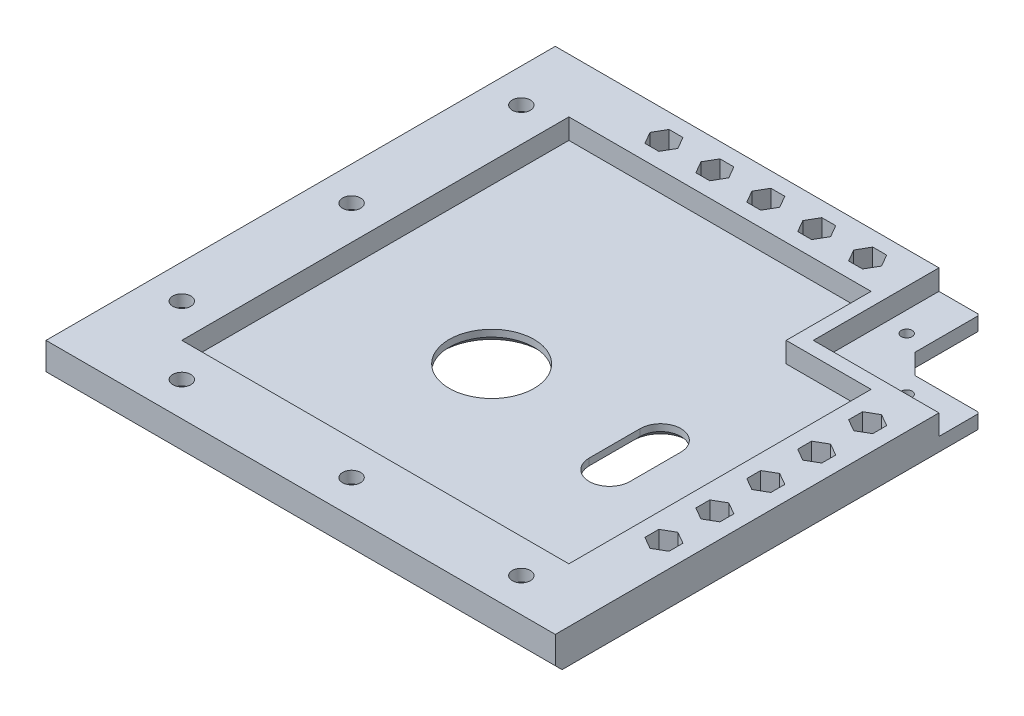
from build123d import *

# Parameters (mm, degrees)
SKETCH1_W           = 150
SKETCH1_H           = 150
SKETCH1_R           = 2.15
SKETCH1_R_2         = 2.65
BOSS_EXTRUDE1_DEPTH = 4
SKETCH2_R           = 2.65
BOSS_EXTRUDE2_DEPTH = 6
SKETCH3_R           = 4.5
SKETCH3_R_2         = 12.5
CUT_EXTRUDE1_DEPTH  = 6.5
SKETCH4_W           = 25
SKETCH4_H           = 25
CUT_EXTRUDE2_DEPTH  = 10
SKETCH5_W           = 37
SKETCH5_H           = 37
CUT_EXTRUDE3_DEPTH  = 6
SKETCH6_R           = 1.6
CUT_EXTRUDE4_DEPTH  = 24.5
CHAMFER1_SIZE       = 2
CUT_EXTRUDE5_DEPTH  = 24.5
CHAMFER2_SIZE       = 2
CHAMFER3_SIZE       = 0.5
CHAMFER4_SIZE       = 6


with BuildPart() as part:
    # Sketch1 → Boss-Extrude1 (new body)
    with BuildSketch(Plane(origin=(0, 0, 0), x_dir=(1, 0, 0), z_dir=(0, 1, 0))):
        with Locations((75, 75)):
            Rectangle(SKETCH1_W, SKETCH1_H)
        with Locations(Location((100, 142, 0), (0, 0, 270))):
            Circle(SKETCH1_R, mode=Mode.SUBTRACT)
        with Locations(Location((85, 142, 0), (0, 0, 270))):
            Circle(SKETCH1_R, mode=Mode.SUBTRACT)
        with Locations(Location((70, 142, 0), (0, 0, 270))):
            Circle(SKETCH1_R, mode=Mode.SUBTRACT)
        with Locations(Location((55, 142, 0), (0, 0, 270))):
            Circle(SKETCH1_R, mode=Mode.SUBTRACT)
        with Locations(Location((40, 142, 0), (0, 0, 270))):
            Circle(SKETCH1_R, mode=Mode.SUBTRACT)
        with Locations(Location((142, 40, 0), (0, 0, 270))):
            Circle(SKETCH1_R, mode=Mode.SUBTRACT)
        with Locations(Location((142, 55, 0), (0, 0, 270))):
            Circle(SKETCH1_R, mode=Mode.SUBTRACT)
        with Locations(Location((142, 70, 0), (0, 0, 270))):
            Circle(SKETCH1_R, mode=Mode.SUBTRACT)
        with Locations(Location((142, 85, 0), (0, 0, 270))):
            Circle(SKETCH1_R, mode=Mode.SUBTRACT)
        with Locations(Location((142, 100, 0), (0, 0, 270))):
            Circle(SKETCH1_R, mode=Mode.SUBTRACT)
        with Locations(Location((10, 30, 0), (0, 0, 270))):
            Circle(SKETCH1_R_2, mode=Mode.SUBTRACT)
        with Locations(Location((10, 80, 0), (0, 0, 270))):
            Circle(SKETCH1_R_2, mode=Mode.SUBTRACT)
        with Locations(Location((10, 130, 0), (0, 0, 270))):
            Circle(SKETCH1_R_2, mode=Mode.SUBTRACT)
        with Locations(Location((30, 10, 0), (0, 0, 270))):
            Circle(SKETCH1_R_2, mode=Mode.SUBTRACT)
        with Locations(Location((80, 10, 0), (0, 0, 270))):
            Circle(SKETCH1_R_2, mode=Mode.SUBTRACT)
        with Locations(Location((130, 10, 0), (0, 0, 270))):
            Circle(SKETCH1_R_2, mode=Mode.SUBTRACT)
    extrude(amount=BOSS_EXTRUDE1_DEPTH)

    # Sketch2 → Boss-Extrude2 (add)
    with BuildSketch(Plane(origin=(0, 4, 0), x_dir=(1, 0, 0), z_dir=(0, 1, 0))):
        Polygon((0, 150), (20, 150), (150, 150), (150, 134), (150, 20), (150, 0), (0, 0), align=None)
        with Locations(Location((10, 130, 0), (0, 0, 270))):
            Circle(SKETCH2_R, mode=Mode.SUBTRACT)
        with Locations(Location((10, 80, 0), (0, 0, 270))):
            Circle(SKETCH2_R, mode=Mode.SUBTRACT)
        with Locations(Location((10, 30, 0), (0, 0, 270))):
            Circle(SKETCH2_R, mode=Mode.SUBTRACT)
        with Locations(Location((30, 10, 0), (0, 0, 270))):
            Circle(SKETCH2_R, mode=Mode.SUBTRACT)
        with Locations(Location((80, 10, 0), (0, 0, 270))):
            Circle(SKETCH2_R, mode=Mode.SUBTRACT)
        with Locations(Location((130, 10, 0), (0, 0, 270))):
            Circle(SKETCH2_R, mode=Mode.SUBTRACT)
        Polygon((20, 134), (20, 20), (134, 20), (134, 109), (109, 109), (109, 134), align=None, mode=Mode.SUBTRACT)
        Polygon((59.099186911, 142), (57.049593456, 145.55), (52.950406544, 145.55), (50.900813089, 142), (52.950406544, 138.45), (57.049593456, 138.45), align=None, mode=Mode.SUBTRACT)
        Polygon((44.099186911, 142), (42.049593456, 145.55), (37.950406544, 145.55), (35.900813089, 142), (37.950406544, 138.45), (42.049593456, 138.45), align=None, mode=Mode.SUBTRACT)
        Polygon((74.099186911, 142), (72.049593456, 145.55), (67.950406544, 145.55), (65.900813089, 142), (67.950406544, 138.45), (72.049593456, 138.45), align=None, mode=Mode.SUBTRACT)
        Polygon((89.099186911, 142), (87.049593456, 145.55), (82.950406544, 145.55), (80.900813089, 142), (82.950406544, 138.45), (87.049593456, 138.45), align=None, mode=Mode.SUBTRACT)
        Polygon((104.099186911, 142), (102.049593456, 145.55), (97.950406544, 145.55), (95.900813089, 142), (97.950406544, 138.45), (102.049593456, 138.45), align=None, mode=Mode.SUBTRACT)
        Polygon((142, 80.900813089), (145.55, 82.950406544), (145.55, 87.049593456), (142, 89.099186911), (138.45, 87.049593456), (138.45, 82.950406544), align=None, mode=Mode.SUBTRACT)
        Polygon((142, 95.900813089), (145.55, 97.950406544), (145.55, 102.049593456), (142, 104.099186911), (138.45, 102.049593456), (138.45, 97.950406544), align=None, mode=Mode.SUBTRACT)
        Polygon((142, 65.900813089), (145.55, 67.950406544), (145.55, 72.049593456), (142, 74.099186911), (138.45, 72.049593456), (138.45, 67.950406544), align=None, mode=Mode.SUBTRACT)
        Polygon((142, 50.900813089), (145.55, 52.950406544), (145.55, 57.049593456), (142, 59.099186911), (138.45, 57.049593456), (138.45, 52.950406544), align=None, mode=Mode.SUBTRACT)
        Polygon((142, 35.900813089), (145.55, 37.950406544), (145.55, 42.049593456), (142, 44.099186911), (138.45, 42.049593456), (138.45, 37.950406544), align=None, mode=Mode.SUBTRACT)
    extrude(amount=BOSS_EXTRUDE2_DEPTH)

    # Sketch3 → Cut-Extrude1 (cut)
    with BuildSketch(Plane.XZ):
        with Locations(Location((10, -130, 0), (0, 0, 270))):
            Circle(SKETCH3_R)
        with Locations(Location((10, -80, 0), (0, 0, 270))):
            Circle(SKETCH3_R)
        with Locations(Location((10, -30, 0), (0, 0, 270))):
            Circle(SKETCH3_R)
        with Locations(Location((30, -10, 0), (0, 0, 270))):
            Circle(SKETCH3_R)
        with Locations(Location((80, -10, 0), (0, 0, 270))):
            Circle(SKETCH3_R)
        with Locations(Location((130, -10, 0), (0, 0, 270))):
            Circle(SKETCH3_R)
        with Locations(Location((65.625, -65.625, 0), (0, 0, 270))):
            Circle(SKETCH3_R_2)
    extrude(amount=-CUT_EXTRUDE1_DEPTH, mode=Mode.SUBTRACT)

    # Sketch4 → Cut-Extrude2 (cut)
    with BuildSketch(Plane(origin=(0, 10, 0), x_dir=(1, 0, 0), z_dir=(0, 1, 0))):
        with Locations((137.5, 137.5)):
            Rectangle(SKETCH4_W, SKETCH4_H)
    extrude(amount=-CUT_EXTRUDE2_DEPTH, mode=Mode.SUBTRACT)

    # Sketch5 → Cut-Extrude3 (cut)
    with BuildSketch(Plane(origin=(0, 10, 0), x_dir=(1, 0, 0), z_dir=(0, 1, 0))):
        with Locations((131.5, 131.5)):
            Rectangle(SKETCH5_W, SKETCH5_H)
    extrude(amount=-CUT_EXTRUDE3_DEPTH, mode=Mode.SUBTRACT)

    # Sketch6 → Cut-Extrude4 (cut)
    with BuildSketch(Plane(origin=(0, 4, 0), x_dir=(1, 0, 0), z_dir=(0, 1, 0))):
        with Locations(Location((119, 134.5, 0), (0, 0, 270))):
            Circle(SKETCH6_R)
        with Locations(Location((134.5, 119, 0), (0, 0, 270))):
            Circle(SKETCH6_R)
    extrude(amount=-CUT_EXTRUDE4_DEPTH, mode=Mode.SUBTRACT)

    # Chamfer1
    chamfer1_edges = [part.edges().sort_by_distance(p)[0] for p in [
        (75, 0, 0),
        (0, 0, -75),
    ]]
    chamfer(chamfer1_edges, length=CHAMFER1_SIZE)

    # Sketch7 → Cut-Extrude5 (cut)
    with BuildSketch(Plane.XZ):
        with BuildLine():
            Line((104, -71), (104, -56))
            ThreePointArc((104, -56), (110, -50), (116, -56))
            Line((116, -56), (116, -71))
            ThreePointArc((116, -71), (110, -77), (104, -71))
        make_face()
    extrude(amount=-CUT_EXTRUDE5_DEPTH, mode=Mode.SUBTRACT)

    # Chamfer2
    chamfer2_edges = [part.edges().sort_by_distance(p)[0] for p in [
        (65.625, 0, -53.125),
        (110, 0, -77),
        (116, 0, -63.5),
        (110, 0, -50),
        (104, 0, -63.5),
    ]]
    chamfer(chamfer2_edges, length=CHAMFER2_SIZE)

    # Chamfer3
    chamfer3_edges = [part.edges().sort_by_distance(p)[0] for p in [
        (125, 2, -150),
        (150, 2, -125),
    ]]
    chamfer(chamfer3_edges, length=CHAMFER3_SIZE)

    # Chamfer4
    chamfer4_edges = [part.edges().sort_by_distance(p)[0] for p in [
        (125, 2, -125),
    ]]
    chamfer(chamfer4_edges, length=CHAMFER4_SIZE)


solid = part.part
